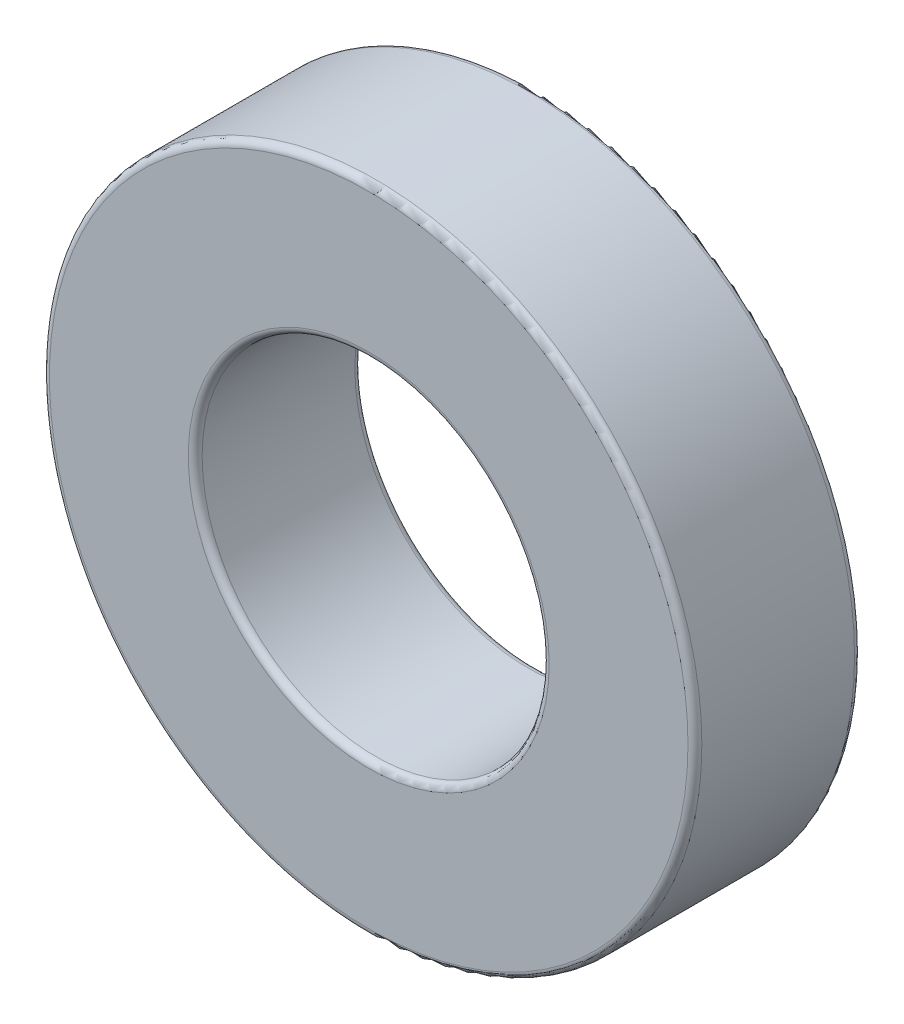
from build123d import *

# Parameters (mm, degrees)
SKETCH1_R           = 23.5
SKETCH1_R_2         = 12.5
BOSS_EXTRUDE1_DEPTH = 12
FILLET1_R           = 0.5
FILLET2_R           = 0.5


with BuildPart() as part:
    # Sketch1 → Boss-Extrude1 (new body)
    with BuildSketch(Plane.XY):
        Circle(SKETCH1_R)
        Circle(SKETCH1_R_2, mode=Mode.SUBTRACT)
    extrude(amount=BOSS_EXTRUDE1_DEPTH)

    # Fillet1
    fillet1_edges = [part.edges().sort_by_distance(p)[0] for p in [
        (-23.5, 0, 0),
        (-23.5, 0, 12),
    ]]
    fillet(fillet1_edges, radius=FILLET1_R)

    # Fillet2
    fillet2_edges = [part.edges().sort_by_distance(p)[0] for p in [
        (-12.5, 0, 0),
        (-12.5, 0, 12),
    ]]
    fillet(fillet2_edges, radius=FILLET2_R)


solid = part.part
